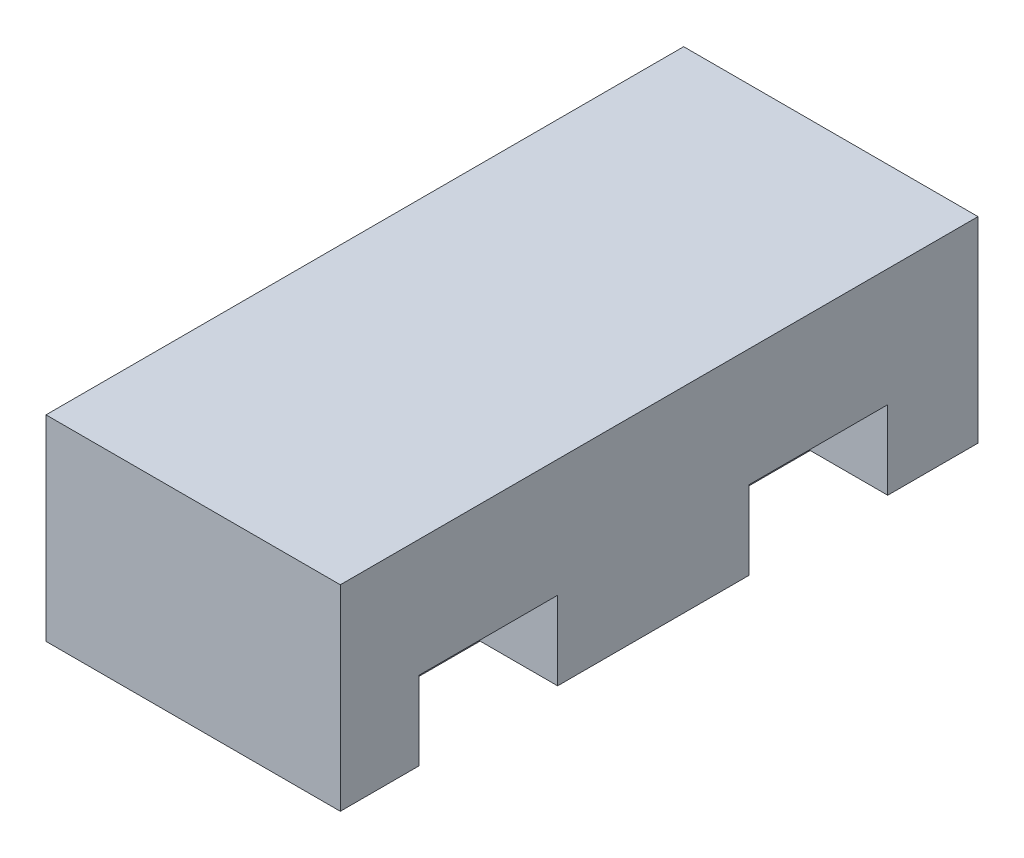
from build123d import *

# Parameters (mm, degrees)
SKETCH_4_W          = 30
SKETCH_4_H          = 65
EXTRUDE_1_DEPTH     = 20
SKETCH_5_W          = 7.9
SKETCH_5_H          = 14.15
CUT_EXTRUDE_1_DEPTH = 8


with BuildPart() as part:
    # 草图4 → 凸台-拉伸1 (new body)
    with BuildSketch(Plane(origin=(0, 0, 0), x_dir=(1, 0, 0), z_dir=(0, 1, 0))):
        Rectangle(SKETCH_4_W, SKETCH_4_H)
    extrude(amount=EXTRUDE_1_DEPTH)

    # 草图5 → 切除-拉伸1 (cut)
    with BuildSketch(Plane(origin=(0, 0, 0), x_dir=(-1, 0, 0), z_dir=(0, -1, 0))):
        with Locations((11.05, -17.425)):
            Rectangle(SKETCH_5_W, SKETCH_5_H)
        with Locations((-11.05, -17.425)):
            Rectangle(SKETCH_5_W, SKETCH_5_H)
        with Locations((11.05, 16.225)):
            Rectangle(SKETCH_5_W, SKETCH_5_H)
        with Locations((-11.05, 16.225)):
            Rectangle(SKETCH_5_W, SKETCH_5_H)
    extrude(amount=-CUT_EXTRUDE_1_DEPTH, mode=Mode.SUBTRACT)


solid = part.part
